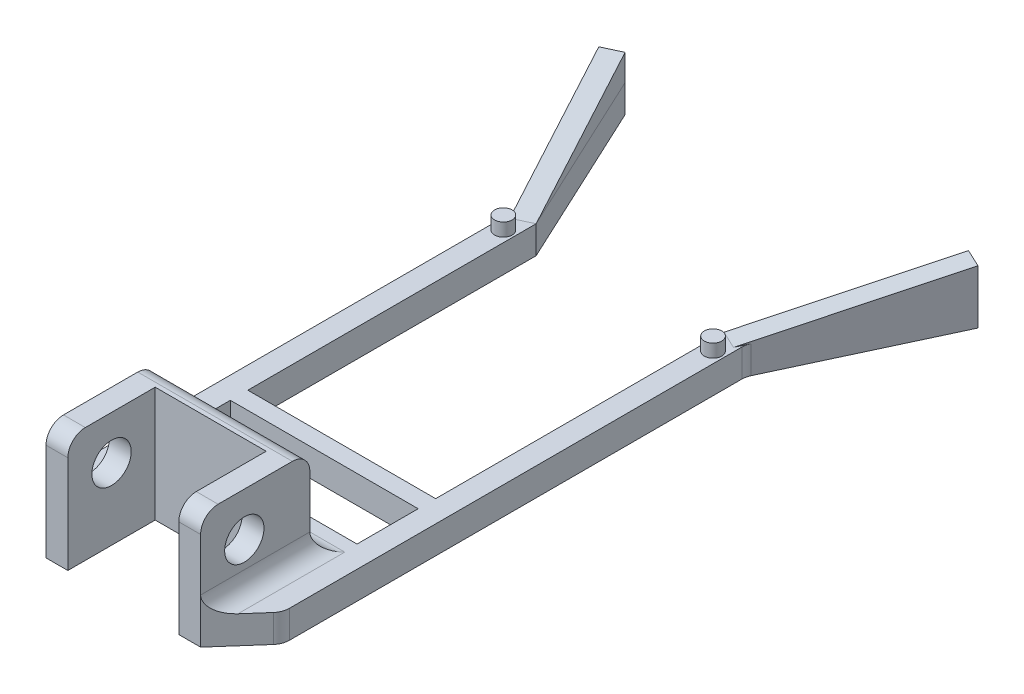
from build123d import *

# Parameters (mm, degrees)
SKETCH1_W           = 21.5
SKETCH1_H           = 7.000000000000002
BOSS_EXTRUDE1_DEPTH = 3.175
SKETCH5_R           = 1.0000000000000018
BOSS_EXTRUDE4_DEPTH = 1.5
BOSS_EXTRUDE2_DEPTH = 2.265769468
BOSS_EXTRUDE3_DEPTH = 10
SKETCH4_R           = 2.250000000000002
CUT_EXTRUDE1_DEPTH  = 62.804050261181395
FILLET1_R           = 2


with BuildPart() as part:
    # Sketch1 → Boss-Extrude1 (new body)
    with BuildSketch(Plane(origin=(0, 0, 0), x_dir=(1, 0, 0), z_dir=(0, 1, 0))):
        Polygon((10.75, 0), (10.750000000000005, 33), (19.64888072270585, 52.0837112946317), (21.702365234814028, 51.126155740732976), (13.250000000000009, 33), (13.250000000000002, -20), (8.85, -25), (6.3500000000000005, -25), (6.3500000000000005, -15), (-6.3500000000000005, -15), (-6.3500000000000005, -25), (-8.85, -25), (-13.250000000000002, -20), (-13.250000000000009, 33), (-21.702365234814028, 51.126155740732976), (-19.64888072270585, 52.0837112946317), (-10.750000000000005, 33), (-10.75, 0), align=None)
        with Locations((0, -5.500000000000001)):
            Rectangle(SKETCH1_W, SKETCH1_H, mode=Mode.SUBTRACT)
    extrude(amount=BOSS_EXTRUDE1_DEPTH)

    # Sketch5 → Boss-Extrude4 (add)
    with BuildSketch(Plane(origin=(0, 3.175, 0), x_dir=(1, 0, 0), z_dir=(0, 1, 0))):
        with Locations(Location((12.000000000000007, 30.500000000000004, 0), (0, 0, 90))):
            Circle(SKETCH5_R)
    boss_extrude4 = extrude(amount=BOSS_EXTRUDE4_DEPTH)


with BuildPart() as body_2:
    # Sketch2 → Boss-Extrude2 (new body)
    with BuildSketch(Plane(origin=(3.8097499093980356, 0, -1.776515558407624), x_dir=(-0.42261826174070105, 0, -0.9063077870366492), z_dir=(0.9063077870366493, 0, -0.4226182617407011))):
        Polygon((34.451303285921966, 3.175), (55.50784894027372, 6.175), (55.50784894027372, 3.175), align=None)
    boss_extrude2 = extrude(amount=-BOSS_EXTRUDE2_DEPTH)


with BuildPart() as part_1:
    add(part.part)

    # Mirror4: Boss-Extrude4, Boss-Extrude2 across plane
    add(boss_extrude4.mirror(Plane(origin=(0, 0, 0), x_dir=(0, 0, 1), z_dir=(1, 0, 0))))
    add(boss_extrude2.mirror(Plane(origin=(0, 0, 0), x_dir=(0, 0, 1), z_dir=(1, 0, 0))))

    # Sketch3 → Boss-Extrude3 (add)
    with BuildSketch(Plane(origin=(0, 3.175, 0), x_dir=(1, 0, 0), z_dir=(0, 1, 0))):
        Polygon((-6.350000000000001, -15), (6.350000000000001, -15), (6.3500000000000005, -25), (8.850000000000003, -25), (8.850000000000003, -15), (8.850000000000003, -12.499999999999996), (-8.850000000000003, -12.499999999999996), (-8.850000000000003, -15), (-8.850000000000003, -25), (-6.3500000000000005, -25), align=None)
    extrude(amount=BOSS_EXTRUDE3_DEPTH)

    # Sketch4 → Cut-Extrude1 (cut, through all)
    with BuildSketch(Plane(origin=(8.850000000000003, 0, 0), x_dir=(0, 0, -1), z_dir=(1, 0, 0))):
        with Locations((-19.999999999999982, 8.175)):
            Circle(SKETCH4_R)
    extrude(amount=-CUT_EXTRUDE1_DEPTH, mode=Mode.SUBTRACT)

    # Fillet1
    fillet1_edges = [part_1.edges().sort_by_distance(p)[0] for p in [
        (13.250000000000009, 1.5875, -33),
        (13.250000000000002, 1.5875, 20),
        (-13.250000000000002, 1.5875, 20),
        (-13.250000000000009, 1.5875, -33),
        (8.850000000000003, 3.175, 18.75),
        (0, 3.175, 12.499999999999996),
        (-8.850000000000003, 3.175, 18.75),
        (0, 13.175, 12.499999999999996),
        (-7.600000000000001, 13.175, 25),
        (7.600000000000001, 13.175, 25),
    ]]
    fillet(fillet1_edges, radius=FILLET1_R)


solid = Compound([body_2.part, part_1.part])
